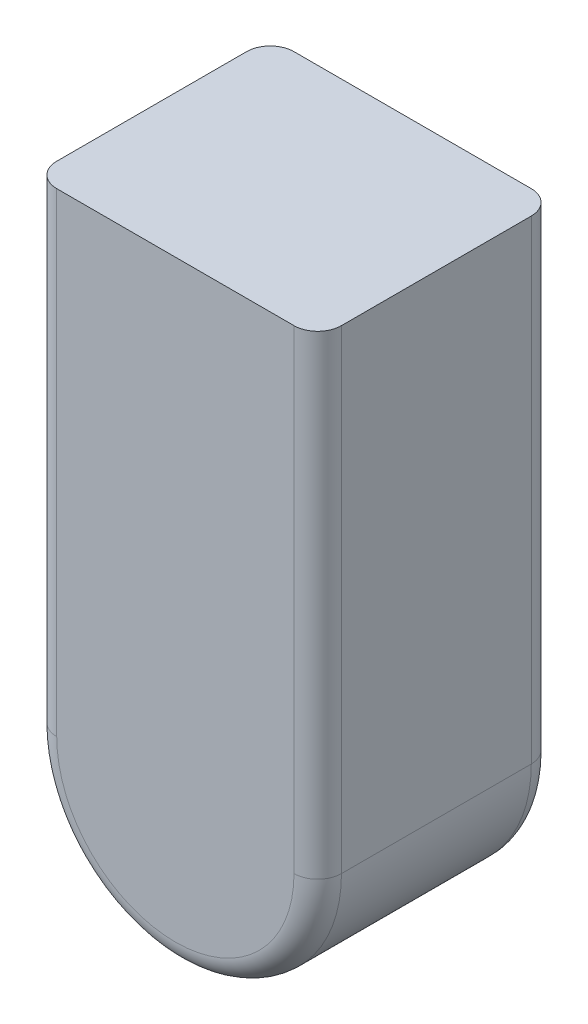
from build123d import *

# Parameters (mm, degrees)
BOSS_EXTRUDE1_DEPTH = 5
FILLET1_R           = 1


with BuildPart() as part:
    # Sketch2 → Boss-Extrude1 (new, symmetric)
    with BuildSketch(Plane.XY):
        with BuildLine():
            Line((-6, 0), (-6, 20))
            Line((-6, 20), (6, 20))
            Line((6, 20), (6, 0))
            ThreePointArc((6, 0), (0, -6), (-6, 0))
        make_face()
    extrude(amount=BOSS_EXTRUDE1_DEPTH, both=True)

    # Fillet1
    fillet1_edges = [part.edges().sort_by_distance(p)[0] for p in [
        (-6, 10, 5),
        (0, -6, 5),
        (-6, 10, -5),
        (6, 10, -5),
        (0, -6, -5),
        (6, 10, 5),
    ]]
    fillet(fillet1_edges, radius=FILLET1_R)


solid = part.part
